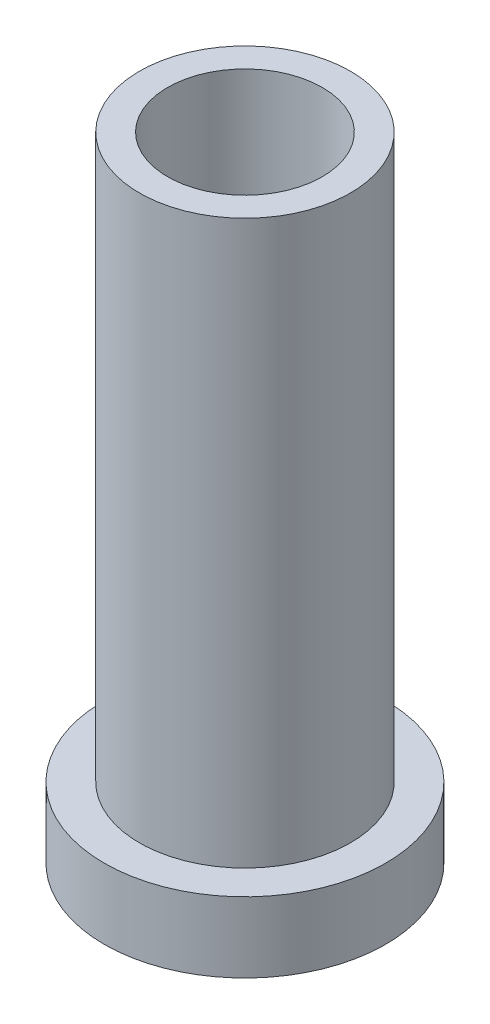
from build123d import *

# Parameters (mm, degrees)
SKETCH1_R           = 10
BOSS_EXTRUDE1_DEPTH = 5
SKETCH1_3_R         = 7.5
BOSS_EXTRUDE2_DEPTH = 45
SKETCH1_4_R         = 5.5
CUT_EXTRUDE1_DEPTH  = 48.16990566


with BuildPart() as part:
    # Sketch1 → Boss-Extrude1 (new body)
    with BuildSketch(Plane(origin=(0, 0, 0), x_dir=(1, 0, 0), z_dir=(0, 1, 0))):
        Circle(SKETCH1_R)
    extrude(amount=BOSS_EXTRUDE1_DEPTH)

    # Sketch1<3> → Boss-Extrude2 (add)
    with BuildSketch(Plane(origin=(0, 0, 0), x_dir=(1, 0, 0), z_dir=(0, 1, 0))):
        Circle(SKETCH1_3_R)
    extrude(amount=BOSS_EXTRUDE2_DEPTH)

    # Sketch1<4> → Cut-Extrude1 (cut, through all)
    with BuildSketch(Plane(origin=(0, 0, 0), x_dir=(1, 0, 0), z_dir=(0, 1, 0))):
        Circle(SKETCH1_4_R)
    extrude(amount=CUT_EXTRUDE1_DEPTH, mode=Mode.SUBTRACT)


solid = part.part
